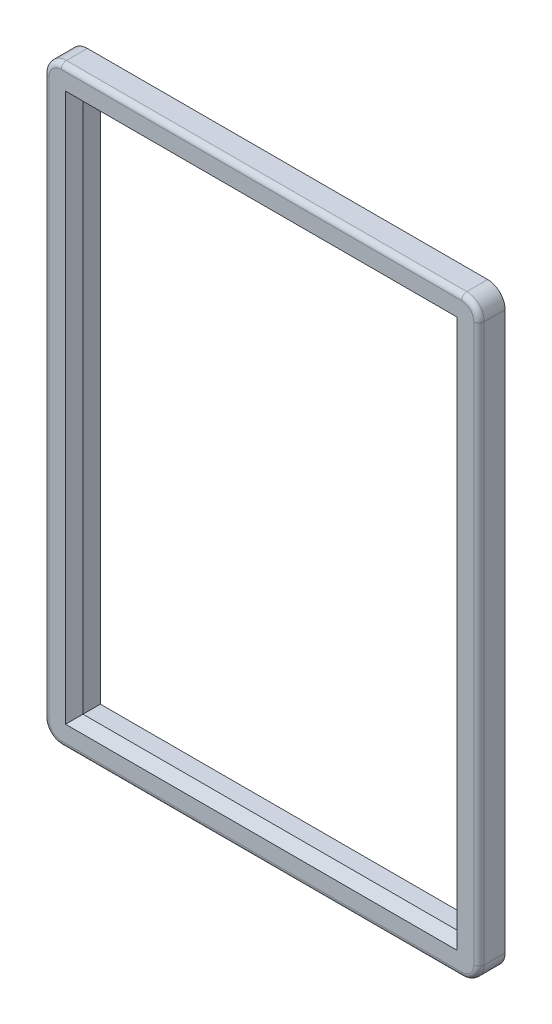
from build123d import *

# Parameters (mm, degrees)
SKETCH_1_W          = 50
SKETCH_1_H          = 68
SKETCH_1_W_2        = 43
SKETCH_1_H_2        = 61
EXTRUDE_1_DEPTH     = 3
FILLET_1_R          = 2
SKETCH_1_5_R        = 0.5
CUT_EXTRUDE_1_DEPTH = 2
FILLET_2_R          = 0.6
CHAMFER_1_SIZE      = 1


with BuildPart() as part:
    # 草图1 → 凸台-拉伸1 (new body)
    with BuildSketch(Plane.XY):
        Rectangle(SKETCH_1_W, SKETCH_1_H)
        Rectangle(SKETCH_1_W_2, SKETCH_1_H_2, mode=Mode.SUBTRACT)
    extrude(amount=EXTRUDE_1_DEPTH)

    # 圆角1
    fillet_1_edges = [part.edges().sort_by_distance(p)[0] for p in [
        (-25, -34, 1.5),
        (25, -34, 1.5),
        (25, 34, 1.5),
        (-25, 34, 1.5),
    ]]
    fillet(fillet_1_edges, radius=FILLET_1_R)

    # 草图1<5> → 切除-拉伸1 (cut)
    with BuildSketch(Plane.XY):
        with Locations((-23, 32)):
            Circle(SKETCH_1_5_R)
        with Locations((23, 32)):
            Circle(SKETCH_1_5_R)
        with Locations((23, -32)):
            Circle(SKETCH_1_5_R)
        with Locations((-23, -32)):
            Circle(SKETCH_1_5_R)
    extrude(amount=CUT_EXTRUDE_1_DEPTH, mode=Mode.SUBTRACT)

    # 圆角2
    fillet_2_edges = [part.edges().sort_by_distance(p)[0] for p in [
        (24.414213562, -33.414213562, 3),
        (0, -34, 3),
        (-24.414213562, -33.414213562, 3),
        (-25, 0, 3),
        (-24.414213562, 33.414213562, 3),
        (0, 34, 3),
        (24.414213562, 33.414213562, 3),
        (25, 0, 3),
    ]]
    fillet(fillet_2_edges, radius=FILLET_2_R)

    # 倒角1
    chamfer_1_edges = [part.edges().sort_by_distance(p)[0] for p in [
        (21.5, 0, 3),
        (0, 30.5, 3),
        (0, -30.5, 3),
        (-21.5, 0, 3),
    ]]
    chamfer(chamfer_1_edges, length=CHAMFER_1_SIZE)


solid = part.part
